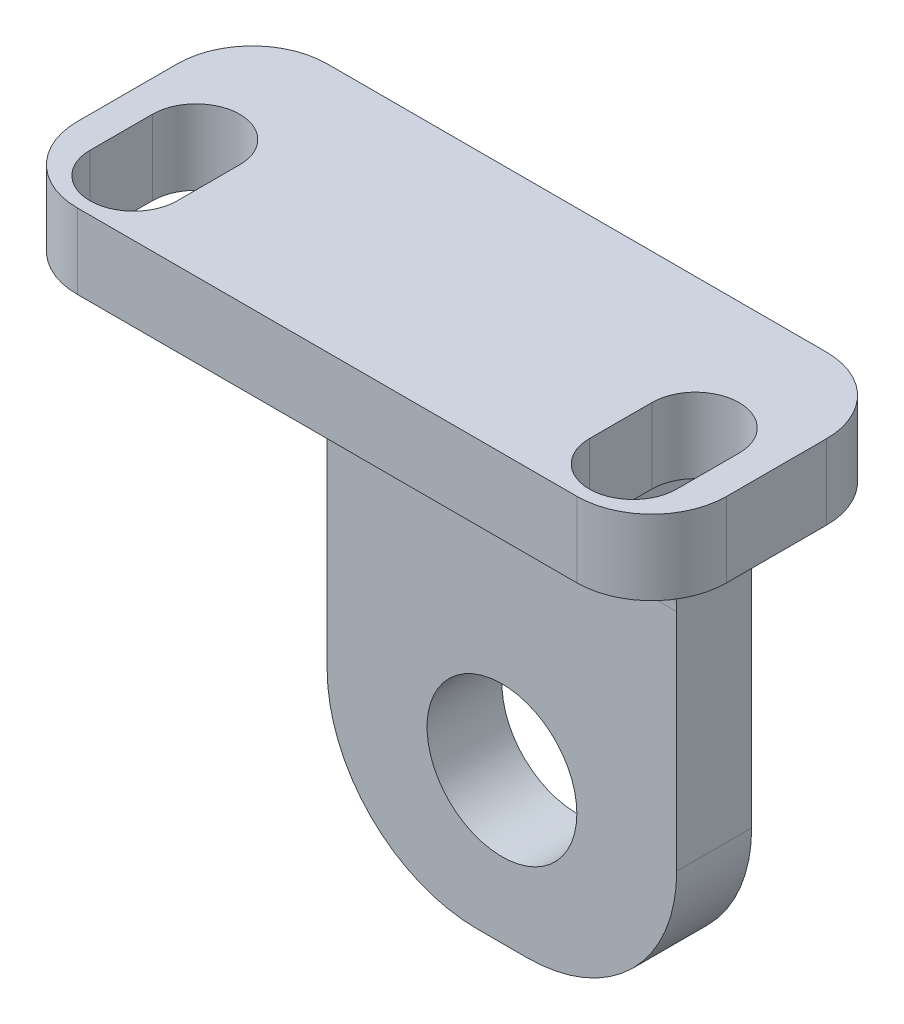
from build123d import *

# Parameters (mm, degrees)
SKETCH1_W           = 14
SKETCH1_H           = 3
BOSS_EXTRUDE1_DEPTH = 24
CUT_EXTRUDE1_REACH  = 27.179
SKETCH2_R           = 3
SKETCH3_W           = 26
SKETCH3_H           = 3
BOSS_EXTRUDE2_DEPTH = 10
CUT_EXTRUDE2_REACH  = 31.069
FILLET1_R           = 3
FILLET2_R           = 6


with BuildPart() as part:
    # Sketch1 → Boss-Extrude1 (new body)
    with BuildSketch(Plane(origin=(0, 0, 0), x_dir=(1, 0, 0), z_dir=(0, 1, 0))):
        with Locations((0, -1.5)):
            Rectangle(SKETCH1_W, SKETCH1_H)
    extrude(amount=BOSS_EXTRUDE1_DEPTH)

    # Sketch2 → Cut-Extrude1 (cut, up to next)
    with BuildSketch(Plane.XY.offset(3), mode=Mode.PRIVATE) as cut_extrude1_sk1:
        with Locations((0, 6)):
            Circle(SKETCH2_R)
    cut_extrude1_tool1 = extrude(cut_extrude1_sk1.sketch, amount=-CUT_EXTRUDE1_REACH, mode=Mode.PRIVATE) & part.part
    add(cut_extrude1_tool1.solids().sort_by_distance((0, 6, 3))[0], mode=Mode.SUBTRACT)

    # Sketch3 → Boss-Extrude2 (add)
    with BuildSketch(Plane.XY):
        with Locations((0, 22.5)):
            Rectangle(SKETCH3_W, SKETCH3_H)
    extrude(amount=BOSS_EXTRUDE2_DEPTH)

    # Sketch4 → Cut-Extrude2 (cut, up to next)
    with BuildSketch(Plane(origin=(0, 24, 0), x_dir=(1, 0, 0), z_dir=(0, 1, 0)), mode=Mode.PRIVATE) as cut_extrude2_sk1:
        with BuildLine():
            ThreePointArc((8.25, -5.25), (10, -3.5), (11.75, -5.25))
            Line((11.75, -5.25), (11.75, -7.75))
            ThreePointArc((11.75, -7.75), (10, -9.5), (8.25, -7.75))
            Line((8.25, -7.75), (8.25, -5.25))
        make_face()
    cut_extrude2_tool1 = extrude(cut_extrude2_sk1.sketch, amount=-CUT_EXTRUDE2_REACH, mode=Mode.PRIVATE) & part.part
    # Sketch4 → Cut-Extrude2 (cut, up to next)
    with BuildSketch(Plane(origin=(0, 24, 0), x_dir=(1, 0, 0), z_dir=(0, 1, 0)), mode=Mode.PRIVATE) as cut_extrude2_sk2:
        with BuildLine():
            Line((-8.25, -7.75), (-8.25, -5.25))
            ThreePointArc((-8.25, -5.25), (-10, -3.5), (-11.75, -5.25))
            Line((-11.75, -5.25), (-11.75, -7.75))
            ThreePointArc((-11.75, -7.75), (-10, -9.5), (-8.25, -7.75))
        make_face()
    cut_extrude2_tool2 = extrude(cut_extrude2_sk2.sketch, amount=-CUT_EXTRUDE2_REACH, mode=Mode.PRIVATE) & part.part
    add(cut_extrude2_tool1.solids().sort_by_distance((10, 24, 6.5))[0], mode=Mode.SUBTRACT)
    add(cut_extrude2_tool2.solids().sort_by_distance((-10, 24, 6.5))[0], mode=Mode.SUBTRACT)

    # Fillet1
    fillet1_edges = [part.edges().sort_by_distance(p)[0] for p in [
        (13, 22.5, 0),
        (-13, 22.5, 0),
        (13, 22.5, 10),
        (-13, 22.5, 10),
    ]]
    fillet(fillet1_edges, radius=FILLET1_R)

    # Fillet2
    fillet2_edges = [part.edges().sort_by_distance(p)[0] for p in [
        (0, 21, 3),
        (-7, 0, 1.5),
        (7, 0, 1.5),
    ]]
    fillet(fillet2_edges, radius=FILLET2_R)


solid = part.part
